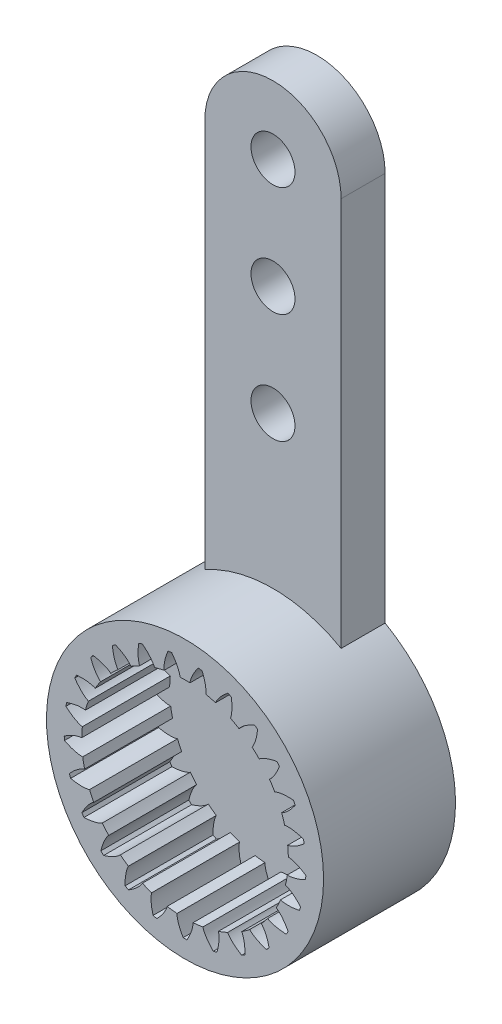
from build123d import *

# Parameters (mm, degrees)
SKETCH_1_R               = 3.150763392
SKETCH_1_R_2             = 2.75
EXTRUDE_1_DEPTH          = 3
EXTRUDE_2_DEPTH          = 3
PATTERN_CIRCULAR_1_COUNT = 25
SKETCH_3_R               = 0.5
EXTRUDE_3_DEPTH          = 1


with BuildPart() as part:
    # 草图1 → 凸台-拉伸1 (new body)
    with BuildSketch(Plane.XY):
        Circle(SKETCH_1_R)
        Circle(SKETCH_1_R_2, mode=Mode.SUBTRACT)
    extrude(amount=EXTRUDE_1_DEPTH)

    # 草图2 → 凸台-拉伸2 (add)
    with BuildSketch(Plane.XY):
        with BuildLine():
            ThreePointArc((0.112549872, 2.346538976), (0, 2.349236608), (-0.112549872, 2.346538976))
            add(Edge.make_bspline(
                [(-0.112549872, 2.346538976), (-0.112843366, 2.350608506), (-0.113575566, 2.356397312), (-0.114840123, 2.364196917), (-0.115956019, 2.370301578), (-0.117380118, 2.377303745), (-0.119149173, 2.385193107), (-0.121298998, 2.39395832), (-0.12386529, 2.40358694), (-0.126883332, 2.414065452), (-0.130388044, 2.425379279), (-0.134413929, 2.437512786), (-0.138995057, 2.450449298), (-0.144165031, 2.464171104), (-0.149956961, 2.478659476), (-0.156403434, 2.493894675), (-0.163536492, 2.509855972), (-0.171387603, 2.526521655), (-0.179987634, 2.543869048), (-0.189366823, 2.561874526), (-0.199554759, 2.58051353), (-0.210580353, 2.599760584), (-0.222471813, 2.619589313), (-0.235256621, 2.639972461), (-0.248961511, 2.66088191), (-0.263612439, 2.682288697), (-0.279234568, 2.704163036), (-0.295852236, 2.726474338), (-0.319752076, 2.757258391), (-0.338674285, 2.780155443), (-0.351783613, 2.795407419)],
                knots=[0, 0, 0, 0, 0.023757473, 0.033984723, 0.046037051, 0.059914458, 0.075616942, 0.093144505, 0.112497145, 0.133674864, 0.156677661, 0.181505536, 0.208158489, 0.23663652, 0.266939629, 0.299067817, 0.333021082, 0.368799426, 0.406402848, 0.445831347, 0.487084925, 0.530163581, 0.575067315, 0.621796127, 0.670350018, 0.720728986, 0.772933033, 0.826962157, 0.88281636, 1, 1, 1, 1], degree=3))
            ThreePointArc((-0.351783613, 2.795407419), (0, 2.817455297), (0.351783613, 2.795407419))
            add(Edge.make_bspline(
                [(0.112549872, 2.346538976), (0.112843366, 2.350608506), (0.113575566, 2.356397312), (0.114840123, 2.364196917), (0.115956019, 2.370301578), (0.117380118, 2.377303745), (0.119149173, 2.385193107), (0.121298998, 2.39395832), (0.12386529, 2.40358694), (0.126883332, 2.414065452), (0.130388044, 2.425379279), (0.134413929, 2.437512786), (0.138995057, 2.450449298), (0.144165031, 2.464171104), (0.149956961, 2.478659476), (0.156403434, 2.493894675), (0.163536492, 2.509855972), (0.171387603, 2.526521655), (0.179987634, 2.543869048), (0.189366823, 2.561874526), (0.199554759, 2.58051353), (0.210580353, 2.599760584), (0.222471813, 2.619589313), (0.235256621, 2.639972461), (0.248961511, 2.66088191), (0.263612439, 2.682288697), (0.279234568, 2.704163036), (0.295852236, 2.726474338), (0.319752076, 2.757258391), (0.338674285, 2.780155443), (0.351783613, 2.795407419)],
                knots=[0, 0, 0, 0, 0.023757473, 0.033984723, 0.046037051, 0.059914458, 0.075616942, 0.093144505, 0.112497145, 0.133674864, 0.156677661, 0.181505536, 0.208158489, 0.23663652, 0.266939629, 0.299067817, 0.333021082, 0.368799426, 0.406402848, 0.445831347, 0.487084925, 0.530163581, 0.575067315, 0.621796127, 0.670350018, 0.720728986, 0.772933033, 0.826962157, 0.88281636, 1, 1, 1, 1], degree=3))
        make_face()
    extrude_2 = extrude(amount=EXTRUDE_2_DEPTH)

    # 阵列(圆周)1: 凸台-拉伸2 ×25 about axis
    pattern_circular_1_axis = Axis((0, 0, 3), (0, 0, -1))
    for i in range(1, PATTERN_CIRCULAR_1_COUNT):
        add(extrude_2.rotate(pattern_circular_1_axis, i * 360 / PATTERN_CIRCULAR_1_COUNT))

    # 草图3 → 凸台-拉伸3 (add)
    with BuildSketch(Plane.XY):
        with BuildLine():
            Line((-1.55, 11.6), (-1.55, 2.568559908))
            ThreePointArc((-1.55, 2.568559908), (0, -3), (1.55, 2.568559908))
            Line((1.55, 2.568559908), (1.55, 11.6))
            ThreePointArc((1.55, 11.6), (0, 13.15), (-1.55, 11.6))
        make_face()
        with Locations((0, 11.6)):
            Circle(SKETCH_3_R, mode=Mode.SUBTRACT)
        with Locations((0, 9.1)):
            Circle(SKETCH_3_R, mode=Mode.SUBTRACT)
        with Locations((0, 6.6)):
            Circle(SKETCH_3_R, mode=Mode.SUBTRACT)
    extrude(amount=EXTRUDE_3_DEPTH)


solid = part.part
